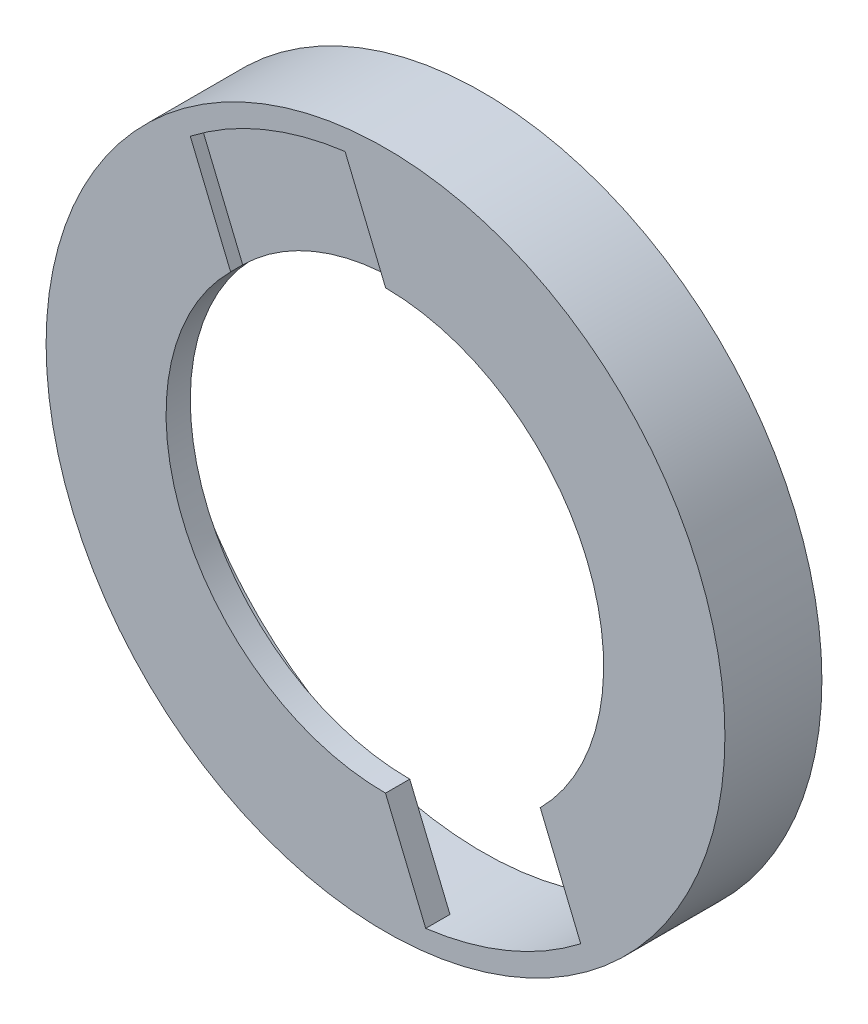
from build123d import *

# Parameters (mm, degrees)
SKETCH1_R           = 14
SKETCH1_R_2         = 13.15
BOSS_EXTRUDE1_DEPTH = 3
BOSS_EXTRUDE2_START = 1
SKETCH2_R           = 14
SKETCH2_R_2         = 9.025
BOSS_EXTRUDE2_DEPTH = 1
CUT_EXTRUDE1_DEPTH  = 21.055785441
CUT_EXTRUDE2_DEPTH  = 0.5


with BuildPart() as part:
    # Sketch1 → Boss-Extrude1 (new body)
    with BuildSketch(Plane.XY):
        with Locations((0.026824761, 0.017229283)):
            Circle(SKETCH1_R)
        with Locations((0.026824761, 0.017229283)):
            Circle(SKETCH1_R_2, mode=Mode.SUBTRACT)
    extrude(amount=-BOSS_EXTRUDE1_DEPTH)

    # Sketch2 → Boss-Extrude2 (add)
    with BuildSketch(Plane.XY.offset(BOSS_EXTRUDE2_START)):
        with Locations((0.026824761, 0.017229283)):
            Circle(SKETCH2_R)
        Circle(SKETCH2_R_2, mode=Mode.SUBTRACT)
    extrude(amount=-BOSS_EXTRUDE2_DEPTH)

    # Sketch3 → Cut-Extrude1 (cut, through all)
    with BuildSketch(Plane(origin=(0, 0, 0), x_dir=(-1, 0, 0), z_dir=(0, 0, -1))):
        with BuildLine():
            Line((-1.684865059, -13.02782351), (-0.026824761, -9.024960135))
            ThreePointArc((-0.026824761, -9.024960135), (-3.480481432, -8.326876605), (-6.403627708, -6.359573664))
            Line((-6.403627708, -6.359573664), (-6.420618215, -6.376564171))
            Line((-6.420618215, -6.376564171), (-8.078658513, -10.379427546))
            ThreePointArc((-8.078658513, -10.379427546), (-5.059111896, -12.131786569), (-1.684865059, -13.02782351))
        make_face()
    extrude(amount=-CUT_EXTRUDE1_DEPTH, mode=Mode.SUBTRACT)

    # Sketch4 → Cut-Extrude2 (cut)
    with BuildSketch(Plane.XY.offset(1)):
        with BuildLine():
            ThreePointArc((-6.362642541, 6.400578481), (-3.426918892, 8.349062936), (0.031150913, 9.024946239))
            Line((0.031150913, 9.024946239), (-1.640669197, 13.061077025))
            ThreePointArc((-1.640669197, 13.061077025), (-5.009864402, 12.164420822), (-8.025008992, 10.413886112))
            Line((-8.025008992, 10.413886112), (-6.362642541, 6.400578481))
        make_face()
    extrude(amount=-CUT_EXTRUDE2_DEPTH, mode=Mode.SUBTRACT)


solid = part.part
